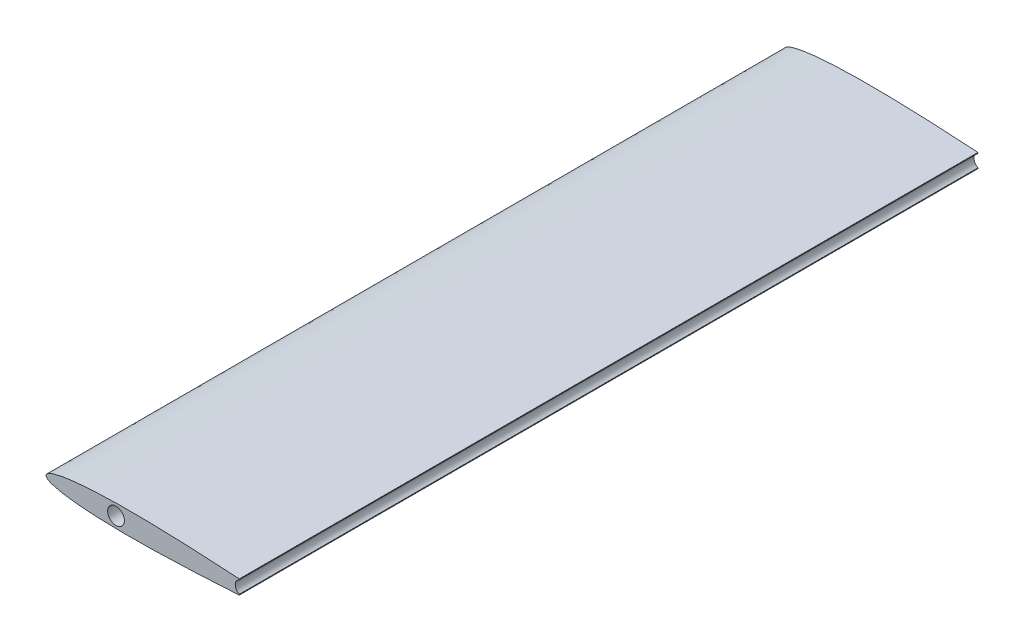
from build123d import *

# Parameters (mm, degrees)
CORPOFOAM_DEPTH        = 263.67
SCHIZZO2_W             = 3
SCHIZZO2_H             = 5.01489576
SMUSSOPOSTERIORE_DEPTH = 273.833056966
SCHIZZO3_R             = 3
FOROLONGHERONE_DEPTH   = 273.578203408


with BuildPart() as part:
    # Schizzo1 → CorpoFoam (new body)
    with BuildSketch(Plane.XY):
        with BuildLine():
            ThreePointArc((70, 2.443), (67.557, 0), (70, -2.443))
            add(Edge.make_bspline(
                [(70, 2.443), (66.667669045, 2.659279734), (60.003104625, 3.061747723), (50.003008601, 3.552139212), (40.002598558, 3.902946494), (31.666961486, 4.025260151), (24.9991546, 3.976933791), (19.997775587, 3.844976398), (14.993363131, 3.592486959), (10.827184065, 3.237651579), (7.489054388, 2.814021367), (4.99359465, 2.403673059), (2.84962634, 1.867925494), (1.165413503, 1.320987252), (-0.664613784, 0), (1.165413503, -1.320987252), (2.84962634, -1.867925494), (4.99359465, -2.403673059), (7.489054388, -2.814021367), (10.827184065, -3.237651579), (14.993363131, -3.592486959), (19.997775587, -3.844976398), (24.9991546, -3.976933791), (31.666961486, -4.025260151), (40.002598558, -3.902946494), (50.003008601, -3.552139212), (60.003104625, -3.061747723), (66.667669045, -2.659279734), (70, -2.443)],
                knots=[0.149112224, 0.149112224, 0.149112224, 0.149112224, 0.198750974, 0.248359097, 0.29793737, 0.347491327, 0.37226694, 0.397050924, 0.421859475, 0.446731346, 0.459220451, 0.471790602, 0.484560454, 0.491195112, 0.5, 0.508804888, 0.515439546, 0.528209398, 0.540779549, 0.553268654, 0.578140525, 0.602949076, 0.62773306, 0.652508673, 0.70206263, 0.751640903, 0.801249026, 0.850887776, 0.850887776, 0.850887776, 0.850887776], degree=3))
        make_face()
    extrude(amount=CORPOFOAM_DEPTH)

    # Schizzo2 → SmussoPosteriore (cut, through all)
    with BuildSketch(Plane.XY.offset(263.67)):
        with Locations((70.5, 0)):
            Rectangle(SCHIZZO2_W, SCHIZZO2_H)
    extrude(amount=-SMUSSOPOSTERIORE_DEPTH, mode=Mode.SUBTRACT)

    # Schizzo3 → ForoLongherone (cut, through all)
    with BuildSketch(Plane.XY.offset(263.67)):
        with Locations((25, 0)):
            Circle(SCHIZZO3_R)
    extrude(amount=-FOROLONGHERONE_DEPTH, mode=Mode.SUBTRACT)


solid = part.part
